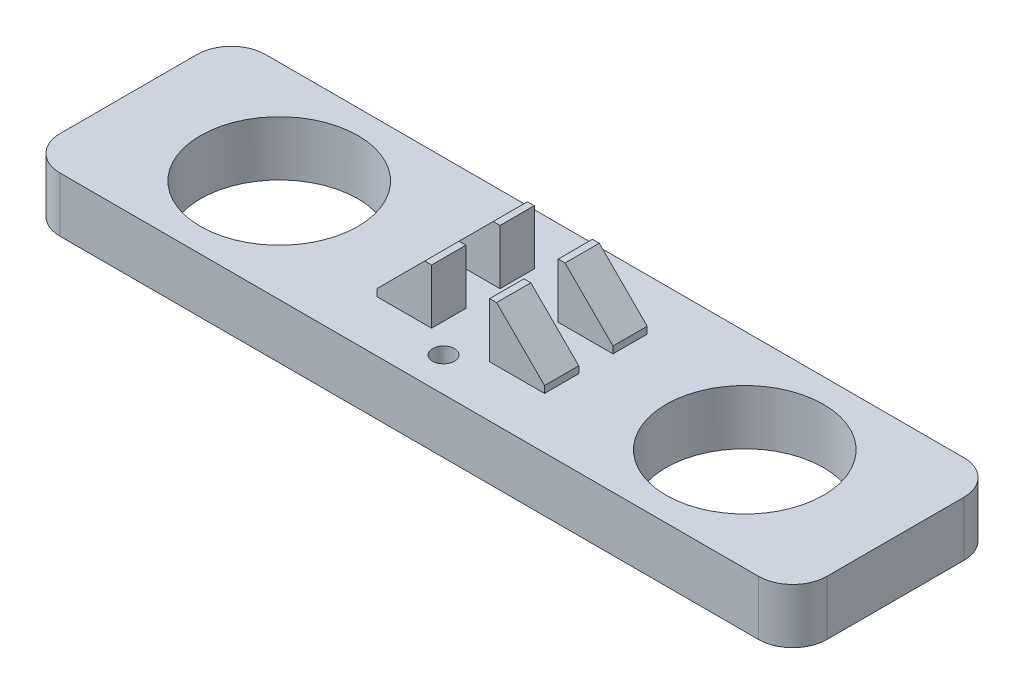
from build123d import *
from build123d.topology import SkipClean

# Parameters (mm, degrees)
SKETCH1_W                = 60
SKETCH1_H                = 30
SKETCH1_R                = 11.5
BOSS_EXTRUDE1_DEPTH      = 5
SKETCH2_R                = 1.6
CUT_EXTRUDE1_DEPTH       = 68.268120235
FILLET1_R                = 5
SKETCH6_R                = 1.6
SKETCH6_R_2              = 11.5
BOSS_EXTRUDE4_DEPTH      = 3
FILLET1_OF_MIRROR1_R     = 5
SKETCH7_W                = 8
SKETCH7_H                = 5
BOSS_EXTRUDE5_DEPTH      = 8
CHAMFER1_SIZE            = 7
CHAMFER1_OF_MIRROR2_SIZE = 7


with BuildPart() as part:
    # Sketch1 → Boss-Extrude1 (new body)
    with BuildSketch(Plane(origin=(0, 0, 0), x_dir=(1, 0, 0), z_dir=(0, 1, 0))):
        with Locations((30, 15)):
            Rectangle(SKETCH1_W, SKETCH1_H)
        with Locations(Location((22, 15, 0), (0, 0, 270))):
            Circle(SKETCH1_R, mode=Mode.SUBTRACT)
    boss_extrude1 = extrude(amount=BOSS_EXTRUDE1_DEPTH)

    # Sketch2 → Cut-Extrude1 (cut, through all)
    with BuildSketch(Plane(origin=(0, 5, 0), x_dir=(1, 0, 0), z_dir=(0, 1, 0))):
        with Locations(Location((56, 25, 0), (0, 0, 270))):
            Circle(SKETCH2_R)
        with Locations(Location((56, 5, 0), (0, 0, 270))):
            Circle(SKETCH2_R)
    cut_extrude1 = extrude(amount=-CUT_EXTRUDE1_DEPTH, mode=Mode.SUBTRACT)

    # Fillet1
    fillet1_edges = [part.edges().sort_by_distance(p)[0] for p in [
        (0, 2.5, -30),
        (0, 2.5, 0),
    ]]
    fillet(fillet1_edges, radius=FILLET1_R)

    # Sketch6 → Boss-Extrude4 (add)
    with SkipClean():  # the faces are left unmerged after this step: merging them gives an invalid solid
        with BuildSketch(Plane.XZ):
            with BuildLine():
                Line((60, -30), (60, 0))
                Line((60, 0), (5, 0))
                ThreePointArc((5, 0), (1.464466094, -1.464466094), (0, -5))
                Line((0, -5), (0, -25))
                ThreePointArc((0, -25), (1.464466094, -28.535533906), (5, -30))
                Line((5, -30), (60, -30))
            make_face()
            with Locations((56, -25)):
                Circle(SKETCH6_R, mode=Mode.SUBTRACT)
            with Locations((22, -15)):
                Circle(SKETCH6_R_2, mode=Mode.SUBTRACT)
            with Locations((56, -5)):
                Circle(SKETCH6_R, mode=Mode.SUBTRACT)
        boss_extrude4 = extrude(amount=BOSS_EXTRUDE4_DEPTH)

    # Mirror1: Boss-Extrude1, Cut-Extrude1, Boss-Extrude4 across plane
    with SkipClean():  # the faces are left unmerged after this step: merging them gives an invalid solid
        add(boss_extrude1.mirror(Plane(origin=(56, 0, 0), x_dir=(0, 0, 1), z_dir=(1, 0, 0))))
        add(cut_extrude1.mirror(Plane(origin=(56, 0, 0), x_dir=(0, 0, 1), z_dir=(1, 0, 0))), mode=Mode.SUBTRACT)
        add(boss_extrude4.mirror(Plane(origin=(56, 0, 0), x_dir=(0, 0, 1), z_dir=(1, 0, 0))))

    # Fillet1 of Mirror1
    fillet1_of_mirror1_edges = [part.edges().sort_by_distance(p)[0] for p in [
        (112, 2.5, -30),
        (112, 2.5, 0),
    ]]
    fillet(fillet1_of_mirror1_edges, radius=FILLET1_OF_MIRROR1_R)

    # Sketch7 → Boss-Extrude5 (add)
    with SkipClean():  # the faces are left unmerged after this step: merging them gives an invalid solid
        with BuildSketch(Plane(origin=(0, 5, 0), x_dir=(1, 0, 0), z_dir=(0, 1, 0))):
            with Locations((47.75, 20)):
                Rectangle(SKETCH7_W, SKETCH7_H)
            with Locations((64.25, 20)):
                Rectangle(SKETCH7_W, SKETCH7_H)
        boss_extrude5 = extrude(amount=BOSS_EXTRUDE5_DEPTH)

    # Chamfer1
    chamfer1_edges = [part.edges().sort_by_distance(p)[0] for p in [
        (43.75, 13, -20),
        (68.25, 13, -20),
    ]]
    chamfer(chamfer1_edges, length=CHAMFER1_SIZE)

    # Mirror2: Boss-Extrude5 across plane
    with SkipClean():  # the faces are left unmerged after this step: merging them gives an invalid solid
        add(boss_extrude5.mirror(Plane(origin=(0, 0, -15), x_dir=(1, 0, 0), z_dir=(0, 0, -1))))

    # Chamfer1 of Mirror2
    chamfer1_of_mirror2_edges = [part.edges().sort_by_distance(p)[0] for p in [
        (43.75, 13, -10),
        (68.25, 13, -10),
    ]]
    chamfer(chamfer1_of_mirror2_edges, length=CHAMFER1_OF_MIRROR2_SIZE)


solid = part.part
